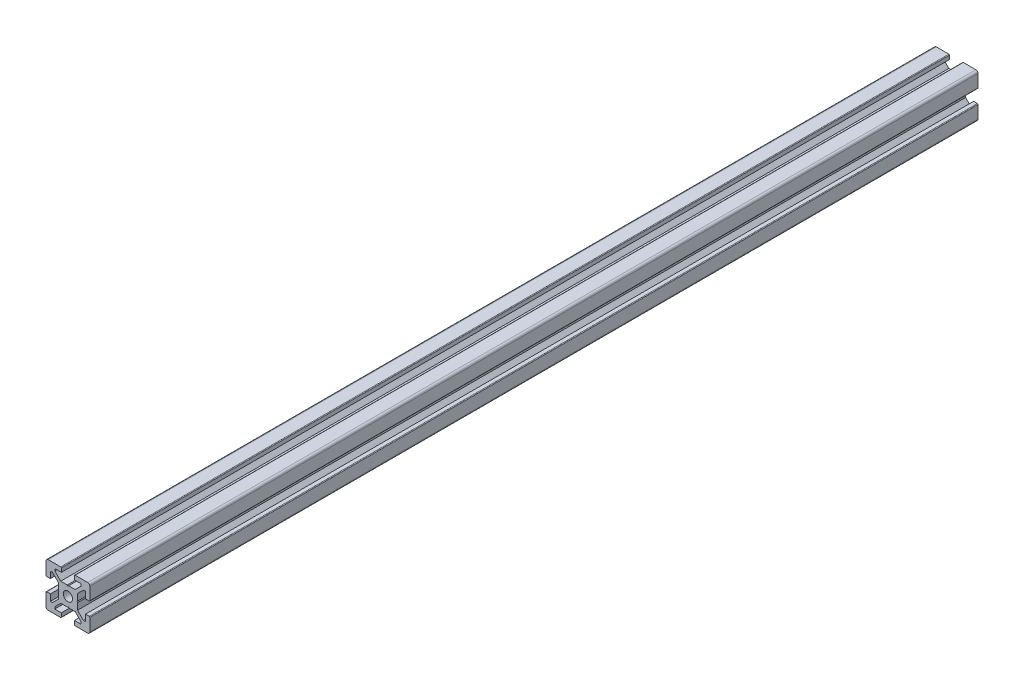
from build123d import *

# Parameters (mm, degrees)
SKETCH1_R           = 2.1
BOSS_EXTRUDE1_DEPTH = 404.96


with BuildPart() as part:
    # Sketch1 → Boss-Extrude1 (new body)
    with BuildSketch(Plane.XY):
        with BuildLine():
            Line((3.3, 4.360660172), (6.000039828, 7.0607))
            Line((6.000039828, 7.0607), (6.000039828, 8))
            Line((6.000039828, 8), (3.000039828, 8))
            Line((3.000039828, 8), (3.000039828, 9.7))
            ThreePointArc((3.000039828, 9.7), (3.087907794, 9.912132034), (3.300039828, 10))
            Line((3.300039828, 10), (9, 10))
            ThreePointArc((9, 10), (9.707106781, 9.707106781), (10, 9))
            Line((10, 9), (10, 3.300039828))
            ThreePointArc((10, 3.300039828), (9.912132034, 3.087907794), (9.7, 3.000039828))
            Line((9.7, 3.000039828), (8, 3.000039828))
            Line((8, 3.000039828), (8, 6.000039828))
            Line((8, 6.000039828), (7.0607, 6.000039828))
            Line((7.0607, 6.000039828), (4.360660172, 3.3))
            Line((4.360660172, 3.3), (4.360660172, 0.3))
            Line((4.360660172, 0.3), (4.060660172, 0))
            Line((4.060660172, 0), (4.360660172, -0.3))
            Line((4.360660172, -0.3), (4.360660172, -3.3))
            Line((4.360660172, -3.3), (7.0607, -6.000039828))
            Line((7.0607, -6.000039828), (8, -6.000039828))
            Line((8, -6.000039828), (8, -3.000039828))
            Line((8, -3.000039828), (9.7, -3.000039828))
            ThreePointArc((9.7, -3.000039828), (9.912132034, -3.087907794), (10, -3.300039828))
            Line((10, -3.300039828), (10, -9))
            ThreePointArc((10, -9), (9.707106781, -9.707106781), (9, -10))
            Line((9, -10), (3.300039828, -10))
            ThreePointArc((3.300039828, -10), (3.087907794, -9.912132034), (3.000039828, -9.7))
            Line((3.000039828, -9.7), (3.000039828, -8))
            Line((3.000039828, -8), (6.000039828, -8))
            Line((6.000039828, -8), (6.000039828, -7.0607))
            Line((6.000039828, -7.0607), (3.3, -4.360660172))
            Line((3.3, -4.360660172), (0.3, -4.360660172))
            Line((0.3, -4.360660172), (0, -4.060660172))
            Line((0, -4.060660172), (-0.3, -4.360660172))
            Line((-0.3, -4.360660172), (-3.3, -4.360660172))
            Line((-3.3, -4.360660172), (-6.000039828, -7.0607))
            Line((-6.000039828, -7.0607), (-6.000039828, -8))
            Line((-6.000039828, -8), (-3.000039828, -8))
            Line((-3.000039828, -8), (-3.000039828, -9.7))
            ThreePointArc((-3.000039828, -9.7), (-3.087907794, -9.912132034), (-3.300039828, -10))
            Line((-3.300039828, -10), (-9, -10))
            ThreePointArc((-9, -10), (-9.707106781, -9.707106781), (-10, -9))
            Line((-10, -9), (-10, -3.300039828))
            ThreePointArc((-10, -3.300039828), (-9.912132034, -3.087907794), (-9.7, -3.000039828))
            Line((-9.7, -3.000039828), (-8, -3.000039828))
            Line((-8, -3.000039828), (-8, -6.000039828))
            Line((-8, -6.000039828), (-7.0607, -6.000039828))
            Line((-7.0607, -6.000039828), (-4.360660172, -3.3))
            Line((-4.360660172, -3.3), (-4.360660172, -0.3))
            Line((-4.360660172, -0.3), (-4.060660172, 0))
            Line((-4.060660172, 0), (-4.360660172, 0.3))
            Line((-4.360660172, 0.3), (-4.360660172, 3.3))
            Line((-4.360660172, 3.3), (-7.0607, 6.000039828))
            Line((-7.0607, 6.000039828), (-8, 6.000039828))
            Line((-8, 6.000039828), (-8, 3.000039828))
            Line((-8, 3.000039828), (-9.7, 3.000039828))
            ThreePointArc((-9.7, 3.000039828), (-9.912132034, 3.087907794), (-10, 3.300039828))
            Line((-10, 3.300039828), (-10, 9))
            ThreePointArc((-10, 9), (-9.707106781, 9.707106781), (-9, 10))
            Line((-9, 10), (-3.300039828, 10))
            ThreePointArc((-3.300039828, 10), (-3.087907794, 9.912132034), (-3.000039828, 9.7))
            Line((-3.000039828, 9.7), (-3.000039828, 8))
            Line((-3.000039828, 8), (-6.000039828, 8))
            Line((-6.000039828, 8), (-6.000039828, 7.0607))
            Line((-6.000039828, 7.0607), (-3.3, 4.360660172))
            Line((-3.3, 4.360660172), (-0.3, 4.360660172))
            Line((-0.3, 4.360660172), (0, 4.060660172))
            Line((0, 4.060660172), (0.3, 4.360660172))
            Line((0.3, 4.360660172), (3.3, 4.360660172))
        make_face()
        Circle(SKETCH1_R, mode=Mode.SUBTRACT)
    extrude(amount=BOSS_EXTRUDE1_DEPTH)


solid = part.part
